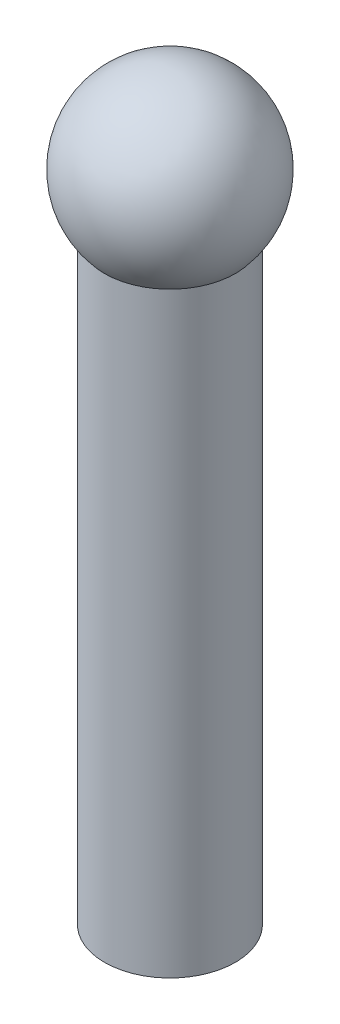
from build123d import *

# Parameters (mm, degrees)
SKETCH1_R           = 7.5
BOSS_EXTRUDE1_DEPTH = 75


with BuildPart() as part:
    # Sketch1 → Boss-Extrude1 (new body)
    with BuildSketch(Plane(origin=(0, 0, 0), x_dir=(1, 0, 0), z_dir=(0, 1, 0))):
        with Locations(Location((0, 0, 0), (0, 0, 270))):
            Circle(SKETCH1_R)
    extrude(amount=BOSS_EXTRUDE1_DEPTH)

    # Sketch3 → Revolve1 (revolve)
    with BuildSketch(Plane(origin=(0, 75, 0), x_dir=(1, 0, 0), z_dir=(0, 1, 0))):
        with BuildLine():
            Line((0, 10), (0, -10))
            ThreePointArc((0, -10), (10, 0), (0, 10))
        make_face()
    revolve(axis=Axis((0, 75, -10), (0, 0, 1)))


solid = part.part
